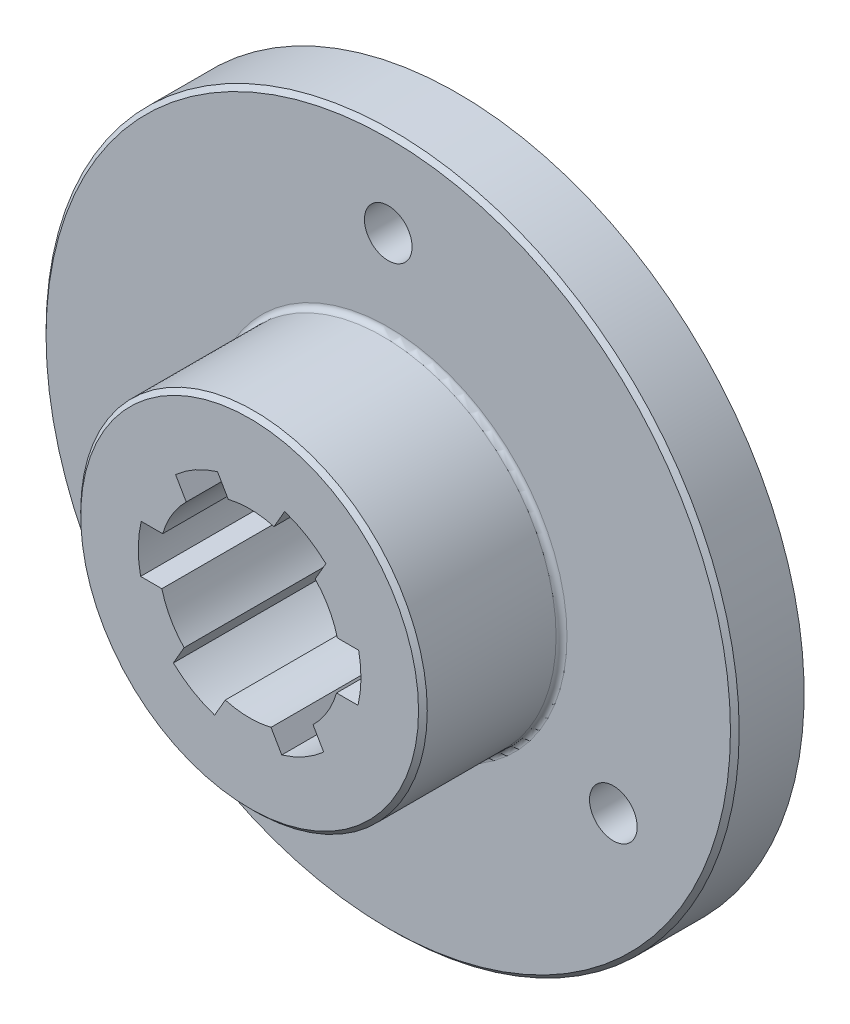
from build123d import *

# Parameters (mm, degrees)
SKETCH1_W           = 38.1
SKETCH1_H           = 6.35
SKETCH2_R           = 15.875
BOSS_EXTRUDE1_DEPTH = 12.7
CUT_EXTRUDE1_DEPTH  = 14.986
SKETCH10_R          = 4
CUT_EXTRUDE3_DEPTH  = 10
FILLET2_R           = 0.5
SKETCH12_R          = 38.1
SKETCH12_R_2        = 31.75
SKETCH12_R_3        = 2.1828
CUT_EXTRUDE8_DEPTH  = 10
CHAMFER1_SIZE       = 0.4
SKETCH13_R          = 9.09
CUT_EXTRUDE9_DEPTH  = 2.54
CUT_EXTRUDE10_DEPTH = 14.986


with BuildPart() as part:
    # Sketch1 → Revolve1 (revolve)
    with BuildSketch(Plane(origin=(0, 0, 0), x_dir=(1, 0, 0), z_dir=(0, 1, 0))):
        with Locations((19.05, 0)):
            Rectangle(SKETCH1_W, SKETCH1_H)
    revolve(axis=Axis((0, 0, -3.175), (0, 0, 1)))

    # Sketch2 → Boss-Extrude1 (add)
    with BuildSketch(Plane.XY.offset(3.175)):
        Circle(SKETCH2_R)
    extrude(amount=BOSS_EXTRUDE1_DEPTH)

    # Sketch3 → Cut-Extrude1 (cut)
    with BuildSketch(Plane.XY.offset(15.875)):
        with BuildLine():
            Line((-7.813605563, 2.134846154), (-9.769464259, 2.134846154))
            ThreePointArc((-9.769464259, 2.134846154), (-9.999052891, 0.137627323), (-9.824520402, -1.865153846))
            Line((-9.824520402, -1.865153846), (-7.882334751, -1.865153846))
            ThreePointArc((-7.882334751, -1.865153846), (-7.083348537, -3.928889601), (-5.755633784, -5.699357836))
            Line((-5.755633784, -5.699357836), (-6.733563132, -7.393181152))
            ThreePointArc((-6.733563132, -7.393181152), (-5.118715203, -8.590620156), (-3.296989588, -9.440861171))
            Line((-3.296989588, -9.440861171), (-2.325896763, -7.758879059))
            ThreePointArc((-2.325896763, -7.758879059), (-0.139156065, -8.098804578), (2.057971779, -7.83420399))
            Line((2.057971779, -7.83420399), (3.035901127, -9.528027306))
            ThreePointArc((3.035901127, -9.528027306), (4.880337688, -8.728247479), (6.527530814, -7.575707325))
            Line((6.527530814, -7.575707325), (5.556437988, -5.893725213))
            ThreePointArc((5.556437988, -5.893725213), (6.944192472, -4.169914977), (7.813605563, -2.134846154))
            Line((7.813605563, -2.134846154), (9.769464259, -2.134846154))
            ThreePointArc((9.769464259, -2.134846154), (9.999052891, -0.137627323), (9.824520402, 1.865153846))
            Line((9.824520402, 1.865153846), (7.882334751, 1.865153846))
            ThreePointArc((7.882334751, 1.865153846), (7.083348537, 3.928889601), (5.755633784, 5.699357836))
            Line((5.755633784, 5.699357836), (6.733563132, 7.393181152))
            ThreePointArc((6.733563132, 7.393181152), (5.118715203, 8.590620156), (3.296989588, 9.440861171))
            Line((3.296989588, 9.440861171), (2.325896763, 7.758879059))
            ThreePointArc((2.325896763, 7.758879059), (0.139156065, 8.098804578), (-2.057971779, 7.83420399))
            Line((-2.057971779, 7.83420399), (-3.035901127, 9.528027306))
            ThreePointArc((-3.035901127, 9.528027306), (-4.880337688, 8.728247479), (-6.527530814, 7.575707325))
            Line((-6.527530814, 7.575707325), (-5.556437988, 5.893725213))
            ThreePointArc((-5.556437988, 5.893725213), (-6.944192472, 4.169914977), (-7.813605563, 2.134846154))
        make_face()
    extrude(amount=-CUT_EXTRUDE1_DEPTH, mode=Mode.SUBTRACT)

    # Sketch10 → Cut-Extrude3 (cut)
    with BuildSketch(Plane.XY.offset(0.889)):
        Circle(SKETCH10_R)
    extrude(amount=-CUT_EXTRUDE3_DEPTH, mode=Mode.SUBTRACT)

    # Fillet2
    fillet2_edges = [part.edges().sort_by_distance(p)[0] for p in [
        (-15.875, 0, 3.175),
    ]]
    fillet(fillet2_edges, radius=FILLET2_R)

    # Sketch12 → Cut-Extrude8 (cut)
    # profile 1 of 4: a face of its own
    with BuildSketch(Plane(origin=(0, 0, -3.175), x_dir=(-1, 0, 0), z_dir=(0, 0, -1))):
        Circle(SKETCH12_R)
        Circle(SKETCH12_R_2, mode=Mode.SUBTRACT)
    # profile 2 of 4: a face of its own
    with BuildSketch(Plane(origin=(0, 0, -3.175), x_dir=(-1, 0, 0), z_dir=(0, 0, -1))):
        with Locations((0, 23.8125)):
            Circle(SKETCH12_R_3)
    # profile 3 of 4: a face of its own
    with BuildSketch(Plane(origin=(0, 0, -3.175), x_dir=(-1, 0, 0), z_dir=(0, 0, -1))):
        with Locations((-20.622229928, -11.90625)):
            Circle(SKETCH12_R_3)
    # profile 4 of 4: a face of its own
    with BuildSketch(Plane(origin=(0, 0, -3.175), x_dir=(-1, 0, 0), z_dir=(0, 0, -1))):
        with Locations((20.622229928, -11.90625)):
            Circle(SKETCH12_R_3)
    extrude(amount=-CUT_EXTRUDE8_DEPTH, mode=Mode.SUBTRACT)

    # Chamfer1
    chamfer1_edges = [part.edges().sort_by_distance(p)[0] for p in [
        (31.75, 0, 3.175),
        (-15.875, 0, 15.875),
    ]]
    chamfer(chamfer1_edges, length=CHAMFER1_SIZE)

    # Sketch13 → Cut-Extrude9 (cut)
    with BuildSketch(Plane(origin=(0, 0, -3.175), x_dir=(-1, 0, 0), z_dir=(0, 0, -1))):
        Circle(SKETCH13_R)
    extrude(amount=-CUT_EXTRUDE9_DEPTH, mode=Mode.SUBTRACT)

    # Sketch11 → Cut-Extrude10 (cut)
    with BuildSketch(Plane.XY.offset(15.875)):
        with BuildLine():
            Line((-6.78285102, 7.617934894), (-5.807963832, 5.929380754))
            ThreePointArc((-5.807963832, 5.929380754), (-7.117065553, 4.270524315), (-7.964828525, 2.334846154))
            Line((-7.964828525, 2.334846154), (-9.929173855, 2.334846154))
            ThreePointArc((-9.929173855, 2.334846154), (-10.199065112, 0.13809719), (-9.988750652, -2.065153846))
            Line((-9.988750652, -2.065153846), (-8.038976278, -2.065153846))
            ThreePointArc((-8.038976278, -2.065153846), (-7.25691532, -4.028297412), (-6.004450346, -5.730320763))
            Line((-6.004450346, -5.730320763), (-6.986623011, -7.43149372))
            ThreePointArc((-6.986623011, -7.43149372), (-5.219128231, -8.763600887), (-3.205899633, -9.68308874))
            Line((-3.205899633, -9.68308874), (-2.231012445, -7.9945346))
            ThreePointArc((-2.231012445, -7.9945346), (-0.139849768, -8.298821726), (1.96037818, -8.065166917))
            Line((1.96037818, -8.065166917), (2.942550844, -9.766339874))
            ThreePointArc((2.942550844, -9.766339874), (4.979936881, -8.901698077), (6.78285102, -7.617934894))
            Line((6.78285102, -7.617934894), (5.807963832, -5.929380754))
            ThreePointArc((5.807963832, -5.929380754), (7.117065553, -4.270524315), (7.964828525, -2.334846154))
            Line((7.964828525, -2.334846154), (9.929173855, -2.334846154))
            ThreePointArc((9.929173855, -2.334846154), (10.199065112, -0.13809719), (9.988750652, 2.065153846))
            Line((9.988750652, 2.065153846), (8.038976278, 2.065153846))
            ThreePointArc((8.038976278, 2.065153846), (7.25691532, 4.028297412), (6.004450346, 5.730320763))
            Line((6.004450346, 5.730320763), (6.986623011, 7.43149372))
            ThreePointArc((6.986623011, 7.43149372), (5.219128231, 8.763600887), (3.205899633, 9.68308874))
            Line((3.205899633, 9.68308874), (2.231012445, 7.9945346))
            ThreePointArc((2.231012445, 7.9945346), (0.139849768, 8.298821726), (-1.96037818, 8.065166917))
            Line((-1.96037818, 8.065166917), (-2.942550844, 9.766339874))
            ThreePointArc((-2.942550844, 9.766339874), (-4.979936881, 8.901698077), (-6.78285102, 7.617934894))
        make_face()
        with BuildLine():
            Line((-9.769464259, 2.134846154), (-7.813605563, 2.134846154))
            ThreePointArc((-7.813605563, 2.134846154), (-6.944192472, 4.169914977), (-5.556437988, 5.893725213))
            Line((-5.556437988, 5.893725213), (-6.527530814, 7.575707325))
            ThreePointArc((-6.527530814, 7.575707325), (-4.880337688, 8.728247479), (-3.035901127, 9.528027306))
            Line((-3.035901127, 9.528027306), (-2.057971779, 7.83420399))
            ThreePointArc((-2.057971779, 7.83420399), (0.139156065, 8.098804578), (2.325896763, 7.758879059))
            Line((2.325896763, 7.758879059), (3.296989588, 9.440861171))
            ThreePointArc((3.296989588, 9.440861171), (5.118715203, 8.590620156), (6.733563132, 7.393181152))
            Line((6.733563132, 7.393181152), (5.755633784, 5.699357836))
            ThreePointArc((5.755633784, 5.699357836), (7.083348537, 3.928889601), (7.882334751, 1.865153846))
            Line((7.882334751, 1.865153846), (9.824520402, 1.865153846))
            ThreePointArc((9.824520402, 1.865153846), (9.999052891, -0.137627323), (9.769464259, -2.134846154))
            Line((9.769464259, -2.134846154), (7.813605563, -2.134846154))
            ThreePointArc((7.813605563, -2.134846154), (6.944192472, -4.169914977), (5.556437988, -5.893725213))
            Line((5.556437988, -5.893725213), (6.527530814, -7.575707325))
            ThreePointArc((6.527530814, -7.575707325), (4.880337688, -8.728247479), (3.035901127, -9.528027306))
            Line((3.035901127, -9.528027306), (2.057971779, -7.83420399))
            ThreePointArc((2.057971779, -7.83420399), (-0.139156065, -8.098804578), (-2.325896763, -7.758879059))
            Line((-2.325896763, -7.758879059), (-3.296989588, -9.440861171))
            ThreePointArc((-3.296989588, -9.440861171), (-5.118715203, -8.590620156), (-6.733563132, -7.393181152))
            Line((-6.733563132, -7.393181152), (-5.755633784, -5.699357836))
            ThreePointArc((-5.755633784, -5.699357836), (-7.083348537, -3.928889601), (-7.882334751, -1.865153846))
            Line((-7.882334751, -1.865153846), (-9.824520402, -1.865153846))
            ThreePointArc((-9.824520402, -1.865153846), (-9.999052891, 0.137627323), (-9.769464259, 2.134846154))
        make_face(mode=Mode.SUBTRACT)
    extrude(amount=-CUT_EXTRUDE10_DEPTH, mode=Mode.SUBTRACT)


solid = part.part
